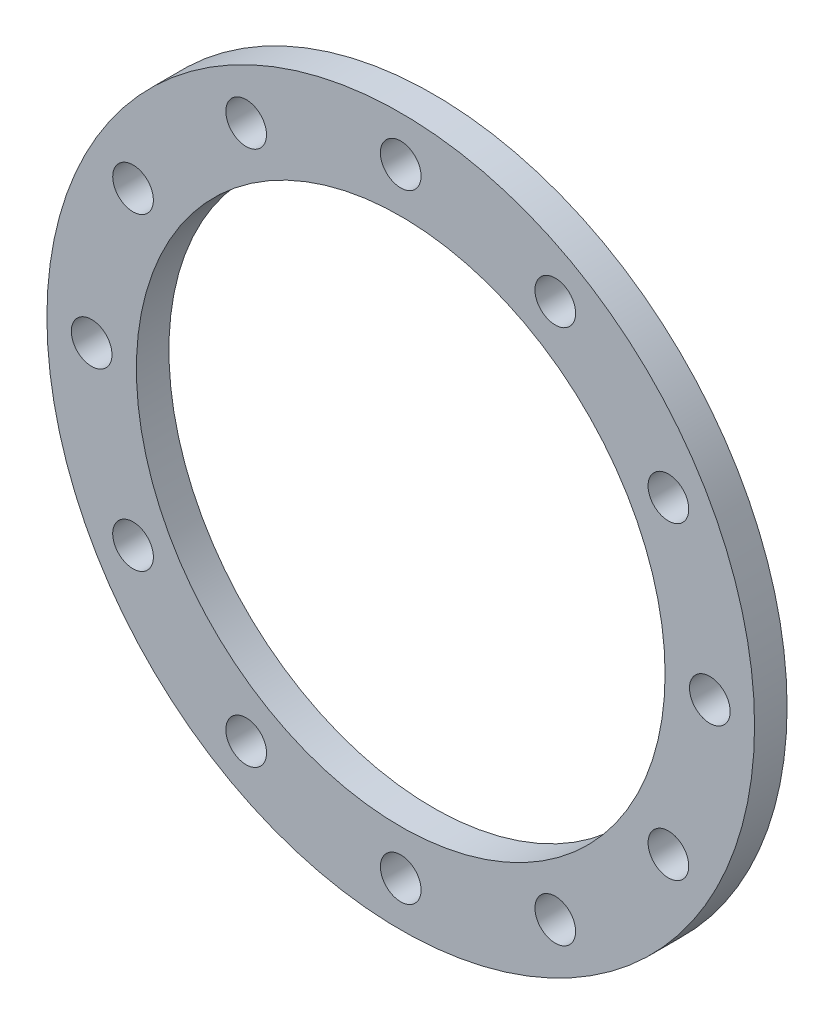
from build123d import *

# Parameters (mm, degrees)
SKETCH1_R          = 43.5
SKETCH1_R_2        = 32.5
BODY_DEPTH         = 4
SKETCH2_R          = 2.5
BOLT_HOLE_DEPTH    = 62.648195432
BOLT_PATTERN_COUNT = 12


with BuildPart() as part:
    # Sketch1 → Body (new body)
    with BuildSketch(Plane.XY):
        Circle(SKETCH1_R)
        Circle(SKETCH1_R_2, mode=Mode.SUBTRACT)
    extrude(amount=BODY_DEPTH)

    # Sketch2 → Bolt Hole (cut, through all)
    with BuildSketch(Plane.XY.offset(4)):
        with Locations((0, 38)):
            Circle(SKETCH2_R)
    bolt_hole = extrude(amount=-BOLT_HOLE_DEPTH, mode=Mode.SUBTRACT)

    # Bolt Pattern: Bolt Hole ×12 about axis
    bolt_pattern_axis = Axis((0, 0, 0), (0, 0, 1))
    for i in range(1, BOLT_PATTERN_COUNT):
        add(bolt_hole.rotate(bolt_pattern_axis, i * 360 / BOLT_PATTERN_COUNT), mode=Mode.SUBTRACT)


solid = part.part
